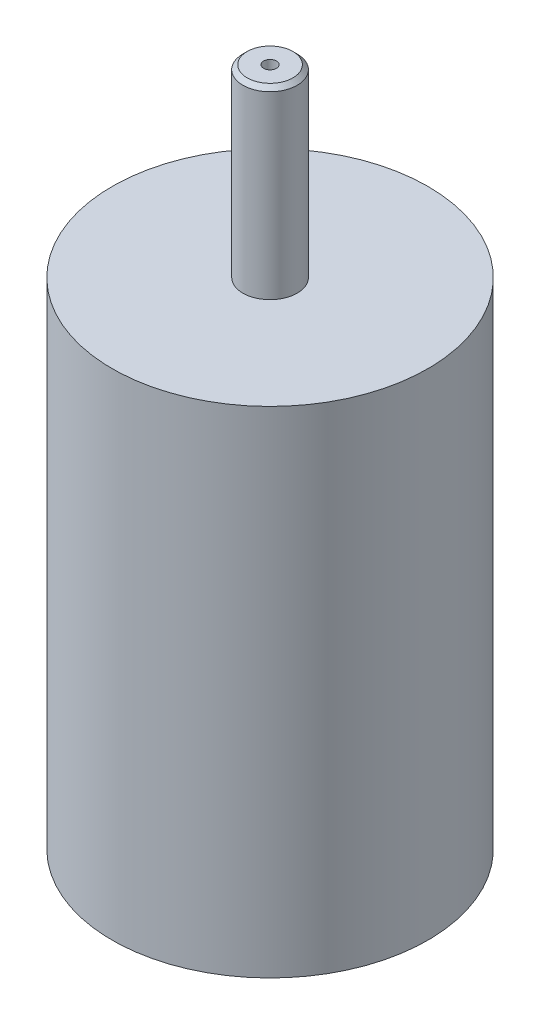
from build123d import *

# Parameters (mm, degrees)
CHAMFER1_SIZE      = 0.5
SKETCH3_R          = 0.75
CUT_EXTRUDE2_DEPTH = 86.691656537


with BuildPart() as part:
    # Sketch1 → Revolve1 (revolve)
    with BuildSketch(Plane(origin=(0, 0, 0), x_dir=(0, 0, -1), z_dir=(1, 0, 0))):
        Polygon((0, -40.8), (0, 40.8), (3.18, 40.8), (3.18, 19.2), (18.5, 19.2), (18.5, -38.8), (3.18, -38.8), (3.18, -40.8), align=None)
    revolve(axis=Axis((0, -40.8, 0), (0, 1, 0)))

    # Chamfer1
    chamfer1_edges = [part.edges().sort_by_distance(p)[0] for p in [
        (0, 40.8, 3.18),
    ]]
    chamfer(chamfer1_edges, length=CHAMFER1_SIZE)

    # Sketch3 → Cut-Extrude2 (cut, through all)
    with BuildSketch(Plane(origin=(0, 40.8, 0), x_dir=(1, 0, 0), z_dir=(0, 1, 0))):
        with Locations(Location((0, 0, 0), (0, 0, 270))):
            Circle(SKETCH3_R)
    extrude(amount=-CUT_EXTRUDE2_DEPTH, mode=Mode.SUBTRACT)


solid = part.part
